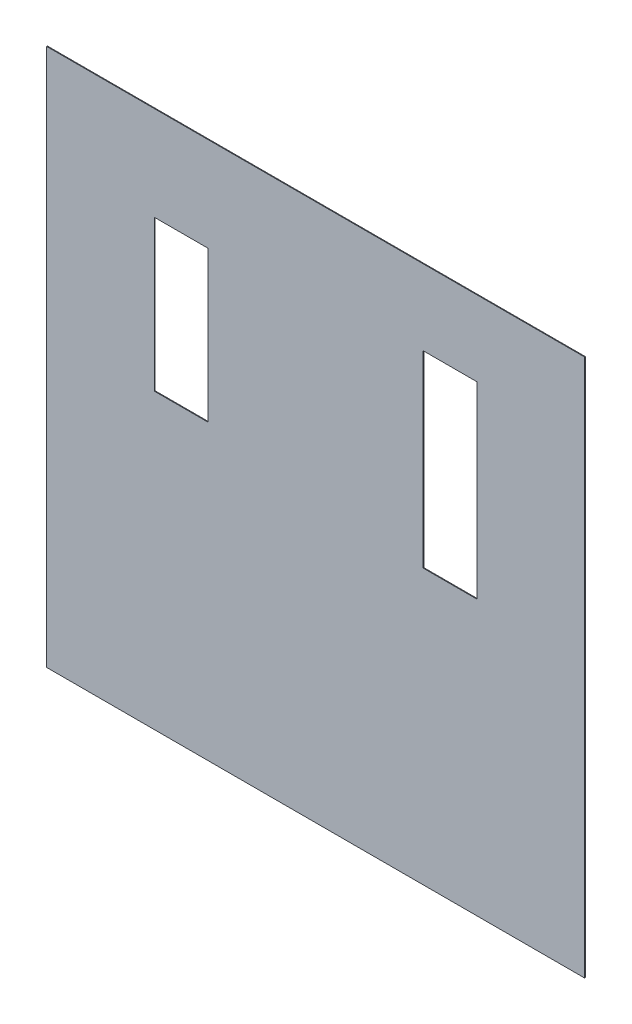
from build123d import *

# Parameters (mm, degrees)
SKETCH1_W           = 25.4
SKETCH1_H           = 25.4
BOSS_EXTRUDE1_DEPTH = 0.03556
SKETCH2_W           = 2.54
SKETCH2_H           = 7.112
SKETCH2_H_2         = 8.89
CUT_EXTRUDE1_DEPTH  = 36.921042086


with BuildPart() as part:
    # Sketch1 → Boss-Extrude1 (new body)
    with BuildSketch(Plane.XY):
        with Locations((12.7, 12.7)):
            Rectangle(SKETCH1_W, SKETCH1_H)
    extrude(amount=BOSS_EXTRUDE1_DEPTH)

    # Sketch2 → Cut-Extrude1 (cut, through all)
    with BuildSketch(Plane.XY.offset(0.03556)):
        with Locations((6.35, 17.399)):
            Rectangle(SKETCH2_W, SKETCH2_H)
        with Locations((19.05, 17.399)):
            Rectangle(SKETCH2_W, SKETCH2_H_2)
    extrude(amount=-CUT_EXTRUDE1_DEPTH, mode=Mode.SUBTRACT)


solid = part.part
